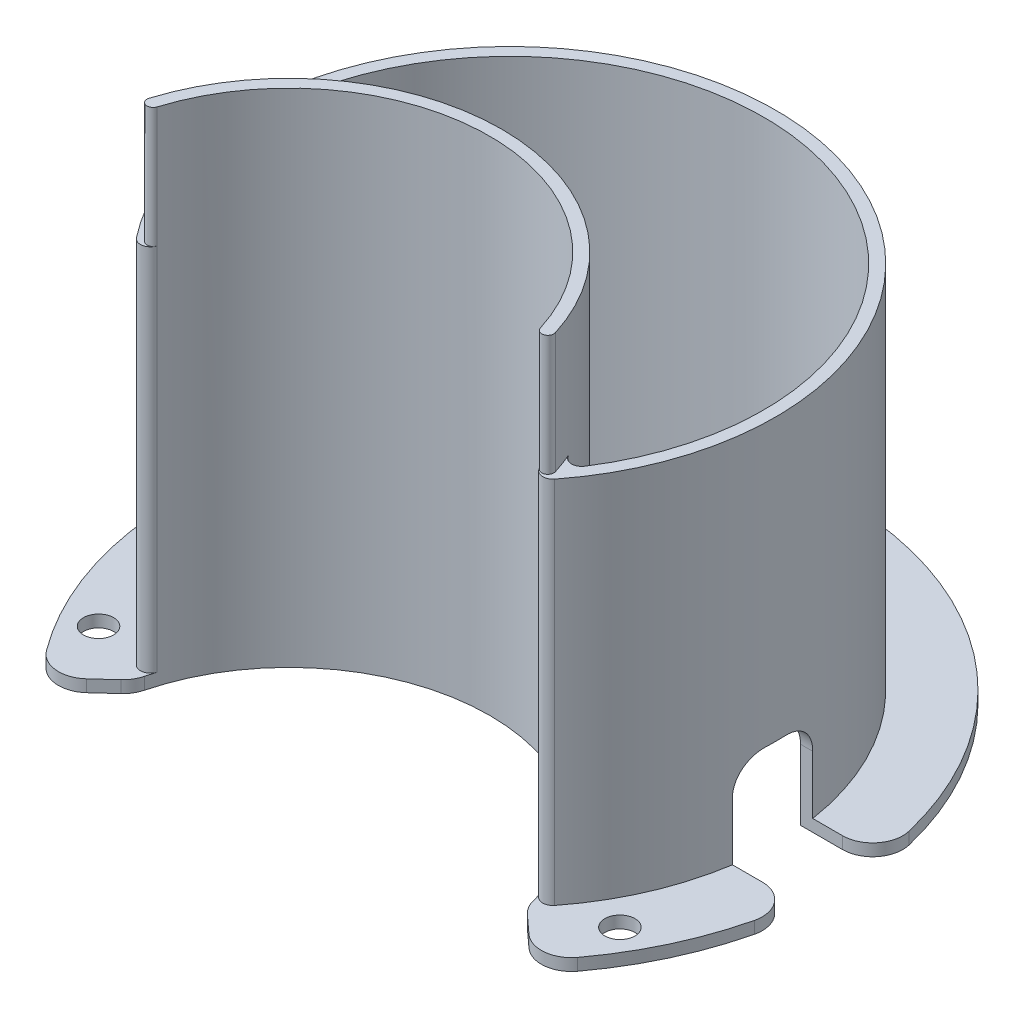
from build123d import *

# Parameters (mm, degrees)
EXTRU_MINCE1_DEPTH      = 38
BOSS_EXTRU_1_DEPTH      = 1.2
CONG_1_R                = 1
BOSS_EXTRU_2_DEPTH      = 12
ESQUISSE4_R             = 1.5
ENL_V_MAT_EXTRU_1_DEPTH = 68.523625665
ESQUISSE5_W             = 8.01820663
ESQUISSE5_H             = 8
ENL_V_MAT_EXTRU_2_DEPTH = 10
CONG_2_R                = 3


with BuildPart() as part:
    # Esquisse1 → Extru.-Mince1 (new body)
    with BuildSketch(Plane(origin=(0, 0, 0), x_dir=(1, 0, 0), z_dir=(0, 1, 0))):
        with BuildLine():
            ThreePointArc((19.5687881, -17.869318182), (0, 26.5), (-19.5687881, -17.869318182))
            ThreePointArc((-19.5687881, -17.869318182), (0, -2), (19.5687881, -17.869318182))
        make_face()
        with BuildLine():
            ThreePointArc((20.124375889, -15.332954545), (0, 25.3), (-20.124375889, -15.332954545))
            ThreePointArc((-20.124375889, -15.332954545), (0, -0.8), (20.124375889, -15.332954545))
        make_face(mode=Mode.SUBTRACT)
    extrude(amount=EXTRU_MINCE1_DEPTH)

    # Esquisse2 → Boss.-Extru.1 (add)
    with BuildSketch(Plane(origin=(0, 0, 0), x_dir=(1, 0, 0), z_dir=(0, 1, 0))):
        with BuildLine():
            Line((-19.5687881, -17.869318182), (-24.368679521, -22.252358491))
            ThreePointArc((-24.368679521, -22.252358491), (0, 33), (24.368679521, -22.252358491))
            Line((24.368679521, -22.252358491), (19.5687881, -17.869318182))
            ThreePointArc((19.5687881, -17.869318182), (0, 26.5), (-19.5687881, -17.869318182))
        make_face()
    extrude(amount=BOSS_EXTRU_1_DEPTH)

    # Congé1
    cong_1_edges = [part.edges().sort_by_distance(p)[0] for p in [
        (-19.5687881, 19.6, 17.869318182),
        (19.5687881, 19.6, 17.869318182),
        (-20.124375889, 19, 15.332954545),
        (20.124375889, 19, 15.332954545),
    ]]
    fillet(cong_1_edges, radius=CONG_1_R)

    # Esquisse3 → Boss.-Extru.2 (add)
    with BuildSketch(Plane(origin=(0, 38, 0), x_dir=(1, 0, 0), z_dir=(0, 1, 0))):
        with BuildLine():
            ThreePointArc((20.241103191, -15.696212121), (19.846650871, -16.447482623), (19.095380369, -16.053030303))
            ThreePointArc((19.095380369, -16.053030303), (0, -2), (-19.095380369, -16.053030303))
            ThreePointArc((-19.095380369, -16.053030303), (-19.846650871, -16.447482623), (-20.241103191, -15.696212121))
            ThreePointArc((-20.241103191, -15.696212121), (0, -0.8), (20.241103191, -15.696212121))
        make_face()
    extrude(amount=BOSS_EXTRU_2_DEPTH)

    # Esquisse4 → Enlèv. mat.-Extru.1 (cut, through all)
    with BuildSketch(Plane(origin=(0, 1.2, 0), x_dir=(1, 0, 0), z_dir=(0, 1, 0))):
        with Locations(Location((-25.980762114, -15, 0), (0, 0, 270))):
            Circle(ESQUISSE4_R)
        with Locations(Location((0, 30, 0), (0, 0, 270))):
            Circle(ESQUISSE4_R)
        with Locations(Location((25.980762114, -15, 0), (0, 0, 270))):
            Circle(ESQUISSE4_R)
    extrude(amount=-ENL_V_MAT_EXTRU_1_DEPTH, mode=Mode.SUBTRACT)

    # Esquisse5 → Enlèv. mat.-Extru.2 (cut)
    with BuildSketch(Plane.XZ):
        with Locations((28.990896685, 0)):
            Rectangle(ESQUISSE5_W, ESQUISSE5_H)
    extrude(amount=-ENL_V_MAT_EXTRU_2_DEPTH, mode=Mode.SUBTRACT)

    # Congé2
    cong_2_edges = [part.edges().sort_by_distance(p)[0] for p in [
        (25.589083583, 10, 4),
        (32.756678708, 0.6, 4),
        (25.589083583, 10, -4),
        (32.756678708, 0.6, -4),
        (-19.5687881, 0.6, 17.869318182),
        (19.5687881, 0.6, 17.869318182),
        (24.368679521, 0.6, 22.252358491),
        (-24.368679521, 0.6, 22.252358491),
    ]]
    fillet(cong_2_edges, radius=CONG_2_R)


solid = part.part
